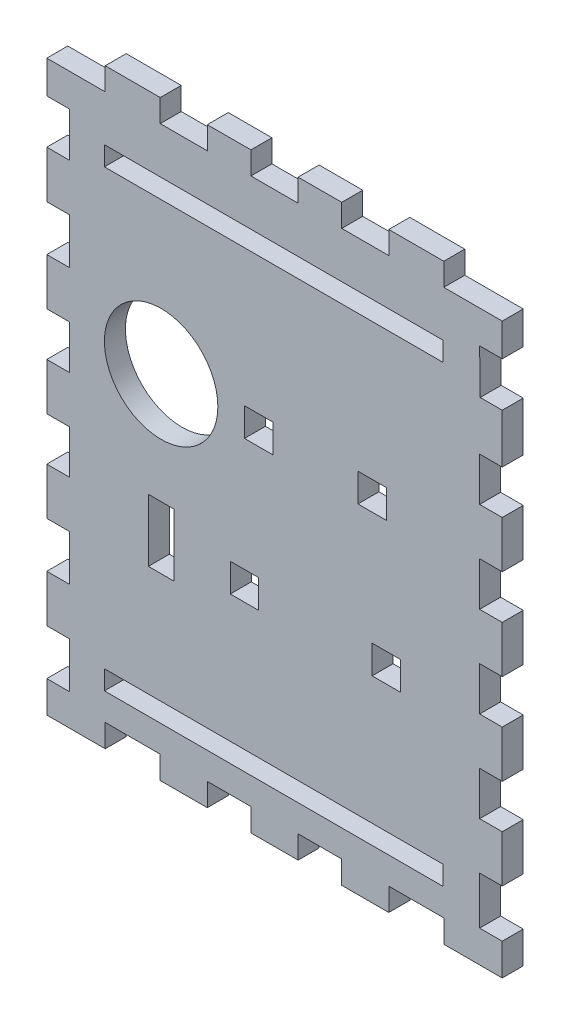
from build123d import *

# Parameters (mm, degrees)
MODEL_W             = 59.689998908
MODEL_H             = 3.386668819
MODEL_H_2           = 3.3866668
BOSS_EXTRUDE1_DEPTH = 3.7
SKETCH1_W           = 5
SKETCH1_H           = 5
SKETCH1_R           = 10
SKETCH1_W_2         = 4.5
SKETCH1_H_2         = 11
CUT_EXTRUDE1_DEPTH  = 10


with BuildPart() as part:
    # Model → Boss-Extrude1 (new body)
    with BuildSketch(Plane.XY):
        Polygon((7.659321824, 131.185313162), (11.645711781, 131.185313467), (11.645711781, 123.120135193), (7.659323163, 123.120135799), (7.659323163, 114.794580784), (11.645711704, 114.794580995), (11.645711704, 106.729402721), (7.659323085, 106.729402721), (7.659322496, 101.163927511), (17.960431856, 101.163927511), (17.960431856, 105.185592023), (27.661820742, 105.185592023), (27.661820742, 101.163927511), (35.952098518, 101.163927511), (35.952098518, 105.185592023), (43.642655148, 105.185592023), (43.642655148, 101.163927511), (51.968212855, 101.163927511), (51.968212855, 105.185592023), (59.658766793, 105.185592023), (59.658766793, 101.163927511), (67.949044569, 101.163927511), (67.949044569, 105.185592023), (77.650433456, 105.185592023), (77.650433456, 101.163927511), (87.951545673, 101.163927511), (87.951545673, 106.78652537), (83.965155709, 106.78652537), (83.965155709, 115.20447842), (87.951545673, 115.204478756), (87.951545673, 123.494756532), (83.965155708, 123.494756532), (83.965155708, 131.185313162), (87.951545168, 131.185313162), (87.951545168, 139.475590938), (83.965156213, 139.475590938), (83.965156213, 147.166147568), (87.951545168, 147.166147568), (87.951545168, 155.456425344), (83.965156213, 155.456425344), (83.965156213, 163.182259213), (87.951545168, 163.182259213), (87.951545168, 171.472536989), (83.965156213, 171.472536989), (83.965156213, 179.163092274), (87.951545169, 179.163092274), (87.951545169, 187.851347209), (84.066213746, 187.851347204), (83.965155204, 195.685953684), (87.951545169, 195.685953684), (87.951544665, 201.458647414), (77.650433455, 201.458647414), (77.650433455, 205.445036033), (67.949044569, 205.445036033), (67.949044569, 201.458647414), (59.658766793, 201.458647414), (59.658766793, 205.445036033), (51.968212854, 205.445036033), (51.968212854, 201.458647414), (43.642655148, 201.458647414), (43.642655148, 205.445036033), (35.952098517, 205.445036033), (35.952098517, 201.458647414), (27.661820742, 201.458647414), (27.661820742, 205.445036033), (17.960431855, 205.445036033), (17.960431855, 201.458647414), (7.659323162, 201.458647414), (7.659321865, 195.685953684), (11.645710483, 195.685953684), (11.645711788, 187.863269672), (7.65932317, 187.863269672), (7.65932317, 179.537714657), (11.645711788, 179.537715263), (11.645711788, 171.472536989), (7.659321824, 171.472536989), (7.659321824, 163.182259214), (11.645711789, 163.182259214), (11.645711789, 155.456425344), (7.659321824, 155.456425344), (7.659321824, 147.166147568), (11.645711789, 147.166147568), (11.645711789, 139.475590938), (7.659321824, 139.475590938), align=None)
        with Locations((47.664322352, 111.627811013)):
            Rectangle(MODEL_W, MODEL_H, mode=Mode.SUBTRACT)
        with Locations((47.664322352, 191.629758602)):
            Rectangle(MODEL_W, MODEL_H_2, mode=Mode.SUBTRACT)
    extrude(amount=BOSS_EXTRUDE1_DEPTH)

    # Sketch1 → Cut-Extrude1 (cut)
    with BuildSketch(Plane.XY.offset(3.7)):
        with Locations((42.509321806, 138.321145422)):
            Rectangle(SKETCH1_W, SKETCH1_H)
        Polygon((47.509321806, 160.821145422), (47.509321806, 163.321145422), (47.509321806, 165.821145422), (42.509321806, 165.821145422), (42.509321806, 160.821145422), align=None)
        Polygon((62.509321806, 165.821145422), (62.509321806, 163.321145422), (62.509321806, 160.821145422), (67.509321806, 160.821145422), (67.509321806, 165.821145422), align=None)
        with Locations((67.509321806, 138.321145422)):
            Rectangle(SKETCH1_W, SKETCH1_H)
        with Locations((27.819322898, 163.321145422)):
            Circle(SKETCH1_R)
        with Locations((27.819322898, 138.321145422)):
            Rectangle(SKETCH1_W_2, SKETCH1_H_2)
    extrude(amount=-CUT_EXTRUDE1_DEPTH, mode=Mode.SUBTRACT)


solid = part.part
